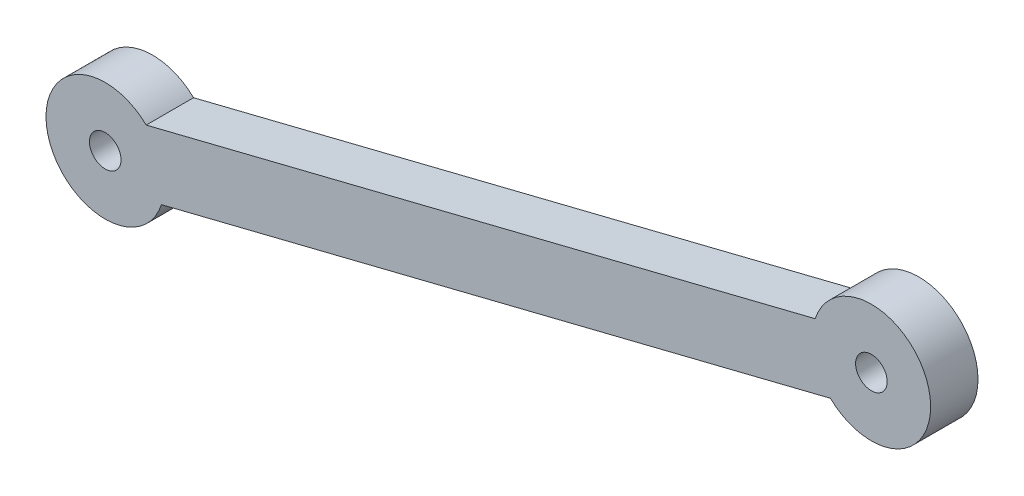
from build123d import *

# Parameters (mm, degrees)
SKETCH1_R           = 2
BOSS_EXTRUDE1_DEPTH = 6


with BuildPart() as part:
    # Sketch1 → Boss-Extrude1 (new body)
    with BuildSketch(Plane(origin=(-250.576496127, -2880.89736156, 0), x_dir=(0.2387018630194584, 0.9710929000827057, 0), z_dir=(0, 0, 1))):
        with BuildLine():
            Line((-29.52735978, 54.320605501), (-49.894496726, 92.934085733))
            ThreePointArc((-49.894496726, 92.934085733), (-59.891411997, 103.313200176), (-56.970497395, 89.201765471))
            Line((-56.970497395, 89.201765471), (-36.603360449, 50.588285239))
            Line((-36.603360449, 50.588285239), (-29.52735978, 54.320605501))
        make_face()
        with Locations((-56.392361751, 96.67944955)):
            Circle(SKETCH1_R, mode=Mode.SUBTRACT)
    extrude(amount=BOSS_EXTRUDE1_DEPTH)

    # Mirror3: part across plane


with BuildPart() as part_1:
    add(part.part)
    add(part.part.mirror(Plane(origin=(-972.146788094, -242.383417146, 6), x_dir=(0, 0, 1), z_dir=(-0.9702957262759991, -0.2419218955996574, 0))))


solid = part_1.part
